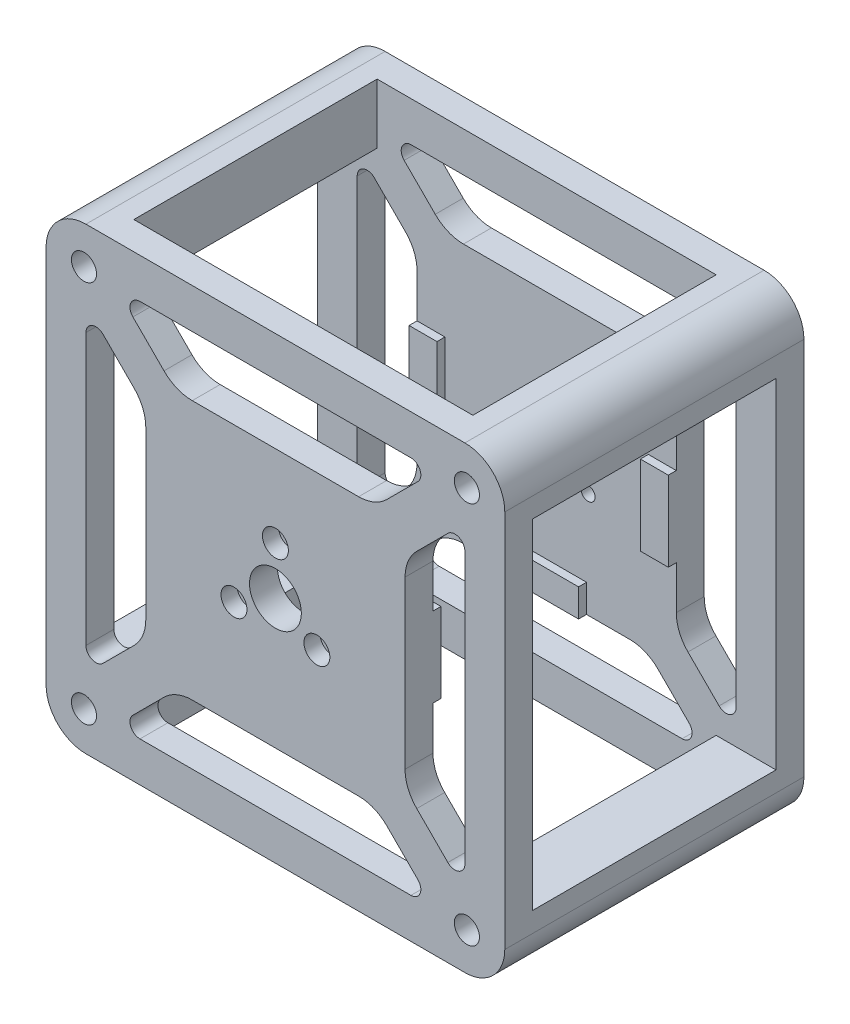
from build123d import *

# Parameters (mm, degrees)
SKETCH1_W                                  = 115
SKETCH1_H                                  = 115
BOSS_EXTRUDE1_DEPTH                        = 37.5
SKETCH3_R                                  = 3.15
CUT_EXTRUDE2_DEPTH                         = 80
MIRROR1_AT_THE_SECOND_PLANE_COPY_1_SKETC_R = 3.15
MIRROR1_AT_THE_SECOND_PLANE_COPY_1_DEPTH   = 80
FILLET1_R                                  = 10
CUT_EXTRUDE3_DEPTH                         = 80
CUT_EXTRUDE6_DEPTH                         = 80
FILLET2_R                                  = 2.5
FILLET3_R                                  = 10
SKETCH9_W                                  = 85
SKETCH9_H                                  = 61
CUT_EXTRUDE7_DEPTH                         = 130
SKETCH10_W                                 = 61
SKETCH10_H                                 = 85
CUT_EXTRUDE8_DEPTH                         = 120
SKETCH12_R                                 = 6.5
CUT_EXTRUDE9_DEPTH                         = 80
SKETCH13_R                                 = 1.75
CUT_EXTRUDE10_DEPTH                        = 80
CIRPATTERN1_COUNT                          = 3
SKETCH14_R                                 = 3.25
CUT_EXTRUDE11_DEPTH                        = 4
CIRPATTERN2_COUNT                          = 3
MIRROR4_COPY_1_SKETCH_R                    = 3.25
MIRROR4_COPY_1_DEPTH                       = 4
MIRROR4_COPY_2_SKETCH_R                    = 3.25
MIRROR4_COPY_2_DEPTH                       = 4
SKETCH17_R                                 = 4
CUT_EXTRUDE12_DEPTH                        = 30
CIRPATTERN3_COUNT                          = 4
SKETCH18_W                                 = 7
SKETCH18_H                                 = 20
SKETCH18_W_2                               = 20
SKETCH18_H_2                               = 7
BOSS_EXTRUDE3_DEPTH                        = 2


with BuildPart() as part:
    # Sketch1 → Boss-Extrude1 (new, symmetric)
    with BuildSketch(Plane.XY):
        Rectangle(SKETCH1_W, SKETCH1_H)
    extrude(amount=BOSS_EXTRUDE1_DEPTH, both=True)

    # Sketch3 → Cut-Extrude2 (cut)
    with BuildSketch(Plane.XY.offset(37.5)):
        with Locations((-48, 48)):
            Circle(SKETCH3_R)
    cut_extrude2 = extrude(amount=-CUT_EXTRUDE2_DEPTH, mode=Mode.SUBTRACT)

    # Mirror1: Cut-Extrude2 across plane
    add(cut_extrude2.mirror(Plane.ZX), mode=Mode.SUBTRACT)

    # Mirror1 at the second plane: Cut-Extrude2 across plane
    add(cut_extrude2.mirror(Plane(origin=(0, 0, 0), x_dir=(0, 0, 1), z_dir=(1, 0, 0))), mode=Mode.SUBTRACT)

    # Mirror1 at the second plane copy 1 sketc → Mirror1 at the second plane copy 1 (cut)
    with BuildSketch(Plane(origin=(0, 0, 37.5), x_dir=(-1, 0, 0), z_dir=(0, 0, 1))):
        with Locations((-48, 48)):
            Circle(MIRROR1_AT_THE_SECOND_PLANE_COPY_1_SKETC_R)
    extrude(amount=-MIRROR1_AT_THE_SECOND_PLANE_COPY_1_DEPTH, mode=Mode.SUBTRACT)

    # Fillet1
    fillet1_edges = [part.edges().sort_by_distance(p)[0] for p in [
        (-57.5, 57.5, 0),
        (57.5, 57.5, 0),
        (57.5, -57.5, 0),
        (-57.5, -57.5, 0),
    ]]
    fillet(fillet1_edges, radius=FILLET1_R)

    # Sketch5 → Cut-Extrude3 (cut)
    with BuildSketch(Plane.XY.offset(37.5)):
        Polygon((-40, 47.5), (-25, 47.5), (25, 47.5), (40, 47.5), (25, 32.5), (-25, 32.5), align=None)
    cut_extrude3 = extrude(amount=-CUT_EXTRUDE3_DEPTH, mode=Mode.SUBTRACT)

    # Mirror2: Cut-Extrude3 across plane
    add(cut_extrude3.mirror(Plane.ZX), mode=Mode.SUBTRACT)

    # Sketch8 → Cut-Extrude6 (cut)
    with BuildSketch(Plane.XY.offset(37.5)):
        Polygon((47.5, 25), (47.5, 40), (32.5, 25), (32.5, -25), (47.5, -40), (47.5, -25), align=None)
    cut_extrude6 = extrude(amount=-CUT_EXTRUDE6_DEPTH, mode=Mode.SUBTRACT)

    # Mirror3: Cut-Extrude6 across plane
    add(cut_extrude6.mirror(Plane(origin=(0, 0, 0), x_dir=(0, 0, 1), z_dir=(1, 0, 0))), mode=Mode.SUBTRACT)

    # Fillet2
    fillet2_edges = [part.edges().sort_by_distance(p)[0] for p in [
        (47.5, 40, 0),
        (47.5, -40, 0),
        (-47.5, 40, 0),
        (-47.5, -40, 0),
        (40, 47.5, 0),
        (-40, 47.5, 0),
        (40, -47.5, 0),
        (-40, -47.5, 0),
    ]]
    fillet(fillet2_edges, radius=FILLET2_R)

    # Fillet3
    fillet3_edges = [part.edges().sort_by_distance(p)[0] for p in [
        (32.5, 25, 0),
        (32.5, -25, 0),
        (-32.5, 25, 0),
        (-32.5, -25, 0),
        (25, 32.5, 0),
        (-25, 32.5, 0),
        (-25, -32.5, 0),
        (25, -32.5, 0),
    ]]
    fillet(fillet3_edges, radius=FILLET3_R)

    # Sketch9 → Cut-Extrude7 (cut)
    with BuildSketch(Plane(origin=(0, 57.5, 0), x_dir=(1, 0, 0), z_dir=(0, 1, 0))):
        Rectangle(SKETCH9_W, SKETCH9_H)
    extrude(amount=-CUT_EXTRUDE7_DEPTH, mode=Mode.SUBTRACT)

    # Sketch10 → Cut-Extrude8 (cut)
    with BuildSketch(Plane(origin=(57.5, 0, 0), x_dir=(0, 0, -1), z_dir=(1, 0, 0))):
        Rectangle(SKETCH10_W, SKETCH10_H)
    extrude(amount=-CUT_EXTRUDE8_DEPTH, mode=Mode.SUBTRACT)

    # Sketch12 → Cut-Extrude9 (cut)
    with BuildSketch(Plane.XY.offset(37.5)):
        Circle(SKETCH12_R)
    extrude(amount=-CUT_EXTRUDE9_DEPTH, mode=Mode.SUBTRACT)

    # Sketch13 → Cut-Extrude10 (cut)
    with BuildSketch(Plane.XY.offset(37.5)):
        with Locations((0, 12)):
            Circle(SKETCH13_R)
    cut_extrude10 = extrude(amount=-CUT_EXTRUDE10_DEPTH, mode=Mode.SUBTRACT)

    # CirPattern1: Cut-Extrude10 ×3 about axis
    cirpattern1_axis = Axis((0, 0, 0), (0, 0, 1))
    for i in range(1, CIRPATTERN1_COUNT):
        add(cut_extrude10.rotate(cirpattern1_axis, i * 360 / CIRPATTERN1_COUNT), mode=Mode.SUBTRACT)

    # Sketch14 → Cut-Extrude11 (cut)
    with BuildSketch(Plane.XY.offset(37.5)):
        with Locations((0, 12)):
            Circle(SKETCH14_R)
    cut_extrude11 = extrude(amount=-CUT_EXTRUDE11_DEPTH, mode=Mode.SUBTRACT)

    # CirPattern2: Cut-Extrude11 ×3 about axis
    cirpattern2_axis = Axis((0, 0, 0), (0, 0, 1))
    for i in range(1, CIRPATTERN2_COUNT):
        add(cut_extrude11.rotate(cirpattern2_axis, i * 360 / CIRPATTERN2_COUNT), mode=Mode.SUBTRACT)

    # Mirror4: Cut-Extrude11 across plane
    add(cut_extrude11.mirror(Plane.XY), mode=Mode.SUBTRACT)

    # Mirror4 copy 1 sketch → Mirror4 copy 1 (cut)
    with BuildSketch(Plane(origin=(0, 0, -37.5), x_dir=(-0.4999999999999998, 0.8660254037844387, 0), z_dir=(0, 0, -1))):
        with Locations((0, -12)):
            Circle(MIRROR4_COPY_1_SKETCH_R)
    extrude(amount=-MIRROR4_COPY_1_DEPTH, mode=Mode.SUBTRACT)

    # Mirror4 copy 2 sketch → Mirror4 copy 2 (cut)
    with BuildSketch(Plane(origin=(0, 0, -37.5), x_dir=(-0.5000000000000004, -0.8660254037844384, 0), z_dir=(0, 0, -1))):
        with Locations((0, -12)):
            Circle(MIRROR4_COPY_2_SKETCH_R)
    extrude(amount=-MIRROR4_COPY_2_DEPTH, mode=Mode.SUBTRACT)

    # Sketch17 → Cut-Extrude12 (cut, symmetric)
    with BuildSketch(Plane.XY):
        with Locations((-48, 48)):
            Circle(SKETCH17_R)
    cut_extrude12 = extrude(amount=CUT_EXTRUDE12_DEPTH, both=True, mode=Mode.SUBTRACT)

    # CirPattern3: Cut-Extrude12 ×4 about axis
    cirpattern3_axis = Axis((0, 0, 0), (0, 0, 1))
    for i in range(1, CIRPATTERN3_COUNT):
        add(cut_extrude12.rotate(cirpattern3_axis, i * 360 / CIRPATTERN3_COUNT), mode=Mode.SUBTRACT)

    # Sketch18 → Boss-Extrude3 (add)
    with BuildSketch(Plane.XY.offset(-30.5)):
        with Locations((-29, 0)):
            Rectangle(SKETCH18_W, SKETCH18_H)
        with Locations((29, 0)):
            Rectangle(SKETCH18_W, SKETCH18_H)
        with Locations((0, -29)):
            Rectangle(SKETCH18_W_2, SKETCH18_H_2)
    boss_extrude3 = extrude(amount=BOSS_EXTRUDE3_DEPTH)

    # Mirror5: Boss-Extrude3 across plane
    add(boss_extrude3.mirror(Plane.XY))


solid = part.part
